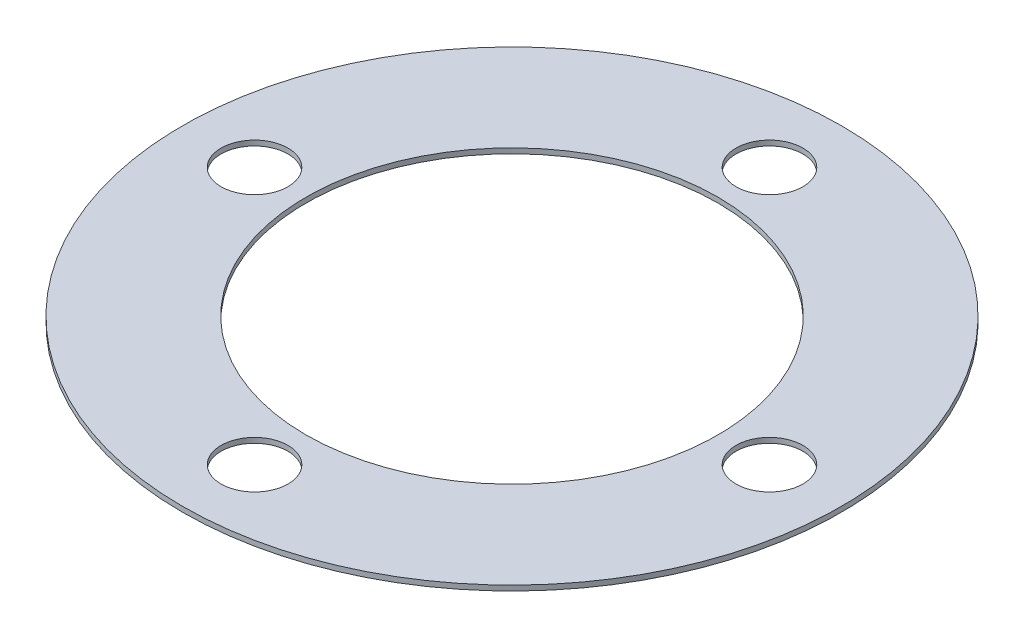
from build123d import *

# Parameters (mm, degrees)
SKETCH2_R           = 32
SKETCH2_R_2         = 20
SKETCH2_R_3         = 3.25
BOSS_EXTRUDE1_DEPTH = 0.5


with BuildPart() as part:
    # Sketch2 → Boss-Extrude1 (new body)
    with BuildSketch(Plane(origin=(0, 0, 0), x_dir=(1, 0, 0), z_dir=(0, 1, 0))):
        with Locations(Location((0, 0, 0), (0, 0, 270))):
            Circle(SKETCH2_R)
        with Locations(Location((0, 0, 0), (0, 0, 270))):
            Circle(SKETCH2_R_2, mode=Mode.SUBTRACT)
        with Locations(Location((0, 25, 0), (0, 0, 270))):
            Circle(SKETCH2_R_3, mode=Mode.SUBTRACT)
        with Locations(Location((25, 0, 0), (0, 0, 270))):
            Circle(SKETCH2_R_3, mode=Mode.SUBTRACT)
        with Locations(Location((0, -25, 0), (0, 0, 270))):
            Circle(SKETCH2_R_3, mode=Mode.SUBTRACT)
        with Locations(Location((-25, 0, 0), (0, 0, 270))):
            Circle(SKETCH2_R_3, mode=Mode.SUBTRACT)
    extrude(amount=BOSS_EXTRUDE1_DEPTH)


solid = part.part
